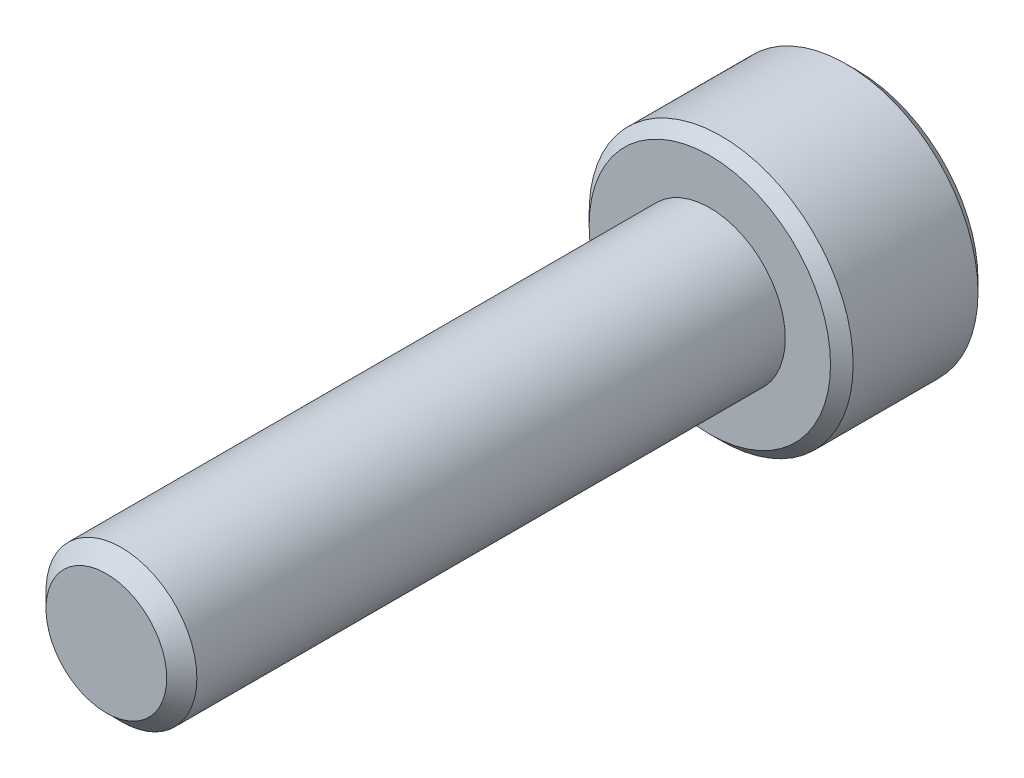
from build123d import *

# Parameters (mm, degrees)
SKETCH_1_R          = 3.5
EXTRUDE_1_DEPTH     = 3.91
SKETCH_2_R          = 2
EXTRUDE_2_DEPTH     = 16
CUT_EXTRUDE_1_DEPTH = 2
CHAMFER_1_SIZE      = 0.4
CHAMFER_2_SIZE      = 0.3


with BuildPart() as part:
    # 草图1 → 凸台-拉伸1 (new body)
    with BuildSketch(Plane.XY):
        Circle(SKETCH_1_R)
    extrude(amount=EXTRUDE_1_DEPTH)

    # 草图2 → 凸台-拉伸2 (add)
    with BuildSketch(Plane.XY.offset(3.91)):
        Circle(SKETCH_2_R)
    extrude(amount=EXTRUDE_2_DEPTH)

    # 草图3 → 切除-拉伸1 (cut)
    with BuildSketch(Plane(origin=(0, 0, 0), x_dir=(-1, 0, 0), z_dir=(0, 0, -1))):
        Polygon((0, 1.760918321), (-1.525, 0.880459161), (-1.525, -0.880459161), (0, -1.760918321), (1.525, -0.880459161), (1.525, 0.880459161), align=None)
    extrude(amount=-CUT_EXTRUDE_1_DEPTH, mode=Mode.SUBTRACT)

    # 倒角1
    chamfer_1_edges = [part.edges().sort_by_distance(p)[0] for p in [
        (-2, 0, 19.91),
    ]]
    chamfer(chamfer_1_edges, length=CHAMFER_1_SIZE)

    # 倒角2
    chamfer_2_edges = [part.edges().sort_by_distance(p)[0] for p in [
        (-3.5, 0, 0),
        (-3.5, 0, 3.91),
    ]]
    chamfer(chamfer_2_edges, length=CHAMFER_2_SIZE)


solid = part.part
